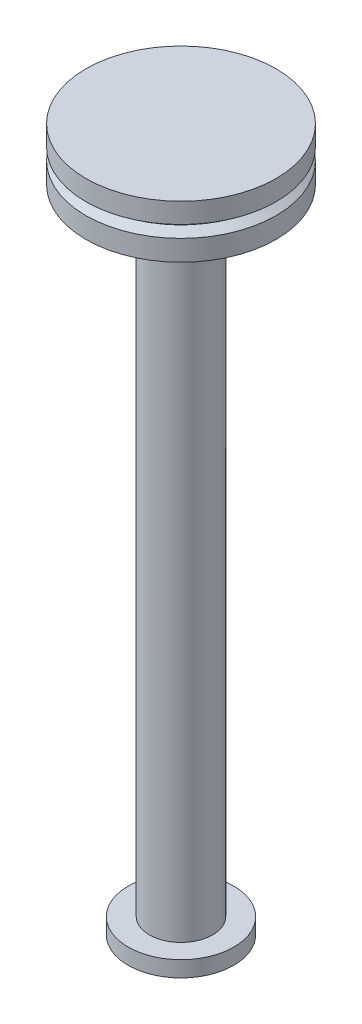
from build123d import *

# Parameters (mm, degrees)
SKETCH3_R           = 10
BOSS_EXTRUDE1_DEPTH = 3


with BuildPart() as part:
    # Sketch1 → Revolve1 (revolve)
    with BuildSketch(Plane.XY, mode=Mode.PRIVATE) as revolve1_sk:
        Polygon((0, 0), (0, 130), (6, 130), (6, 122.525384953), (6, 0), align=None)
    revolve(revolve1_sk.sketch.rotate(Axis((0, 0, 0), (0, 1, 0)), 90), axis=Axis((0, 0, 0), (0, 1, 0)))

    # Sketch2 → Revolve2 (revolve)
    with BuildSketch(Plane.XY, mode=Mode.PRIVATE) as revolve2_sk:
        Polygon((0, 130), (18, 130), (18, 126.185810056), (16.418354863, 125), (18, 123.913651393), (18, 120), (0, 120), align=None)
    revolve(revolve2_sk.sketch.rotate(Axis((0, 130, 0), (0, -1, 0)), 180), axis=Axis((0, 130, 0), (0, -1, 0)))

    # Sketch3 → Boss-Extrude1 (add)
    with BuildSketch(Plane.XZ):
        with Locations(Location((0, 0, 0), (0, 0, 270))):
            Circle(SKETCH3_R)
    extrude(amount=BOSS_EXTRUDE1_DEPTH)


solid = part.part
